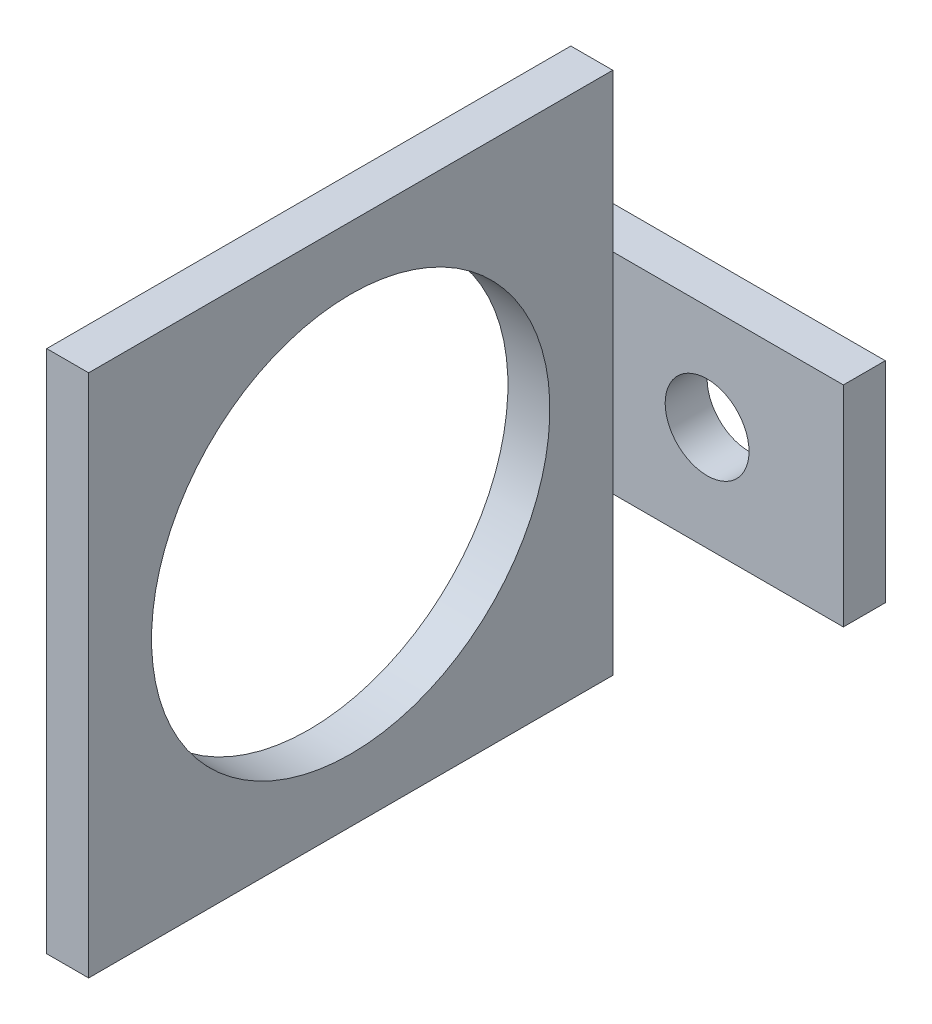
from build123d import *

# Parameters (mm, degrees)
SKETCH1_W           = 13
SKETCH1_H           = 10
BOSS_EXTRUDE1_DEPTH = 2
SKETCH2_W           = 2
SKETCH2_H           = 10
BOSS_EXTRUDE2_DEPTH = 25
SKETCH4_W           = 2
SKETCH4_H           = 25
BOSS_EXTRUDE3_DEPTH = 7.5
SKETCH5_W           = 2
SKETCH5_H           = 25
BOSS_EXTRUDE4_DEPTH = 7.5
SKETCH6_R           = 2
CUT_EXTRUDE1_DEPTH  = 7.5
SKETCH7_R           = 9.5
CUT_EXTRUDE2_DEPTH  = 32.721443851


with BuildPart() as part:
    # Sketch1 → Boss-Extrude1 (new body)
    with BuildSketch(Plane.XY):
        Rectangle(SKETCH1_W, SKETCH1_H)
    extrude(amount=BOSS_EXTRUDE1_DEPTH)

    # Sketch2 → Boss-Extrude2 (add)
    with BuildSketch(Plane.XY.offset(2)):
        with Locations((-5.5, 0)):
            Rectangle(SKETCH2_W, SKETCH2_H)
    extrude(amount=BOSS_EXTRUDE2_DEPTH)

    # Sketch4 → Boss-Extrude3 (add)
    with BuildSketch(Plane(origin=(0, 5, 0), x_dir=(1, 0, 0), z_dir=(0, 1, 0))):
        with Locations((-5.5, -14.5)):
            Rectangle(SKETCH4_W, SKETCH4_H)
    extrude(amount=BOSS_EXTRUDE3_DEPTH)

    # Sketch5 → Boss-Extrude4 (add)
    with BuildSketch(Plane.XZ.offset(5)):
        with Locations((-5.5, 14.5)):
            Rectangle(SKETCH5_W, SKETCH5_H)
    extrude(amount=BOSS_EXTRUDE4_DEPTH)

    # Sketch6 → Cut-Extrude1 (cut)
    with BuildSketch(Plane(origin=(0, 0, 0), x_dir=(-1, 0, 0), z_dir=(0, 0, -1))):
        Circle(SKETCH6_R)
    extrude(amount=-CUT_EXTRUDE1_DEPTH, mode=Mode.SUBTRACT)

    # Sketch7 → Cut-Extrude2 (cut, through all)
    with BuildSketch(Plane(origin=(-4.5, 0, 0), x_dir=(0, 0, -1), z_dir=(1, 0, 0))):
        with Locations(Location((-14.5, 0, 0), (0, 0, 90))):
            Circle(SKETCH7_R)
    extrude(amount=-CUT_EXTRUDE2_DEPTH, mode=Mode.SUBTRACT)


solid = part.part
